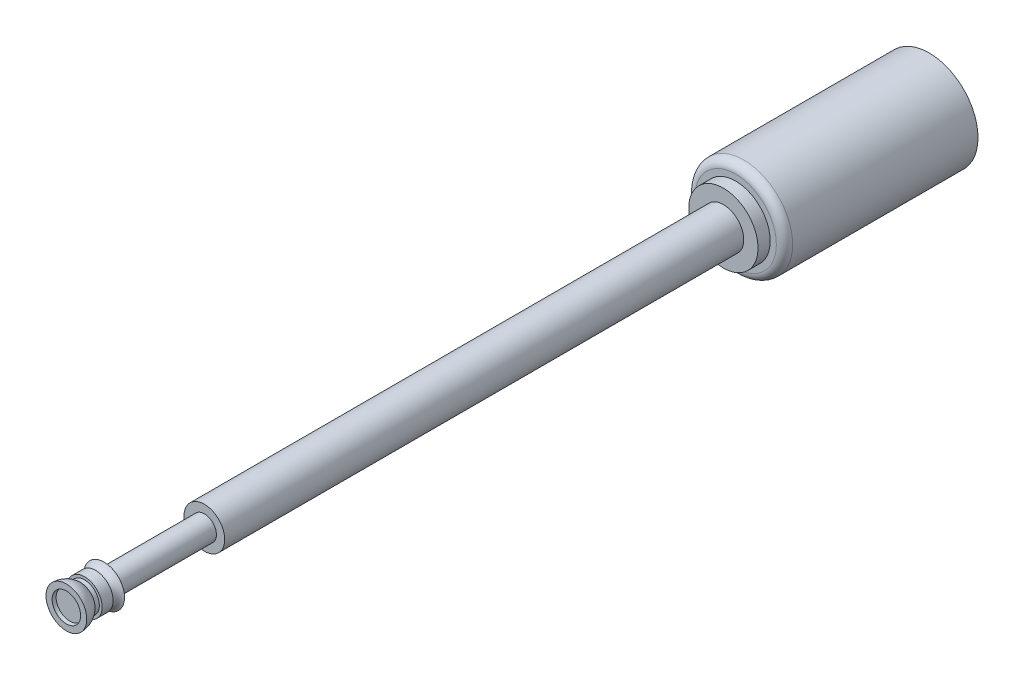
from build123d import *

# Parameters (mm, degrees)
SKETCH1_R           = 12.7
BOSS_EXTRUDE1_DEPTH = 393.7
SKETCH1_3_R         = 30.48
SKETCH1_3_R_2       = 12.7
BOSS_EXTRUDE2_DEPTH = 120.65
FILLET1_R           = 5.08
SKETCH2_R           = 21.59
BOSS_EXTRUDE3_DEPTH = 7.62
SKETCH4_W           = 11.455449348
SKETCH4_H           = 1.487714446
SKETCH5_W           = 19.408085654
SKETCH5_H           = 62.484


with BuildPart() as part:
    # Sketch1 → Boss-Extrude1 (new body)
    with BuildSketch(Plane.XY):
        Circle(SKETCH1_R)
    extrude(amount=BOSS_EXTRUDE1_DEPTH)



with BuildPart() as body_2:
    # Sketch1<3> → Boss-Extrude2 (new body)
    with BuildSketch(Plane.XY):
        Circle(SKETCH1_3_R)
        Circle(SKETCH1_3_R_2, mode=Mode.SUBTRACT)
    extrude(amount=-BOSS_EXTRUDE2_DEPTH)

    # Fillet1
    fillet1_edges = [body_2.edges().sort_by_distance(p)[0] for p in [
        (-30.48, 0, 0),
    ]]
    fillet(fillet1_edges, radius=FILLET1_R)


with BuildPart() as part_1:
    add(part.part)

    add(body_2.part)  # Boss-Extrude3 merges body 2
    # Sketch2 → Boss-Extrude3 (add)
    with BuildSketch(Plane.XY):
        Circle(SKETCH2_R)
    extrude(amount=BOSS_EXTRUDE3_DEPTH)

    # Sketch3 → Revolve2 (revolve)
    with BuildSketch(Plane(origin=(0, 0, 0), x_dir=(1, 0, 0), z_dir=(0, 1, 0))):
        with BuildLine():
            Line((12.7, -393.7), (0, -393.7))
            Line((0, -393.7), (0, -408.3685))
            ThreePointArc((0, -408.3685), (6.286179285, -410.972320715), (8.89, -417.2585))
            Line((8.89, -417.2585), (12.7, -417.2585))
            ThreePointArc((12.7, -417.2585), (11.805440428, -412.576451698), (9.247783259, -408.5539894))
            Line((9.247783259, -408.5539894), (9.247783259, -405.935541368))
            Line((9.247783259, -405.935541368), (10.947551139, -405.935541368))
            Line((10.947551139, -405.935541368), (10.947551139, -399.059207672))
            Line((10.947551139, -399.059207672), (9.170521083, -399.059207672))
            ThreePointArc((9.170521083, -399.059207672), (10.132151594, -395.850690557), (12.7, -393.7))
        make_face()
    revolve(axis=Axis((0, 0, 393.7), (0, 0, 1)))

    # Sketch4 → Revolve3 (revolve)
    with BuildSketch(Plane(origin=(0, 0, 0), x_dir=(1, 0, 0), z_dir=(0, 1, 0))):
        with Locations((-5.727724674, -414.292142777)):
            Rectangle(SKETCH4_W, SKETCH4_H)
    revolve(axis=Axis((0, 0, 393.7), (0, 0, 1)))

    # Sketch5 → Cut-Revolve1 (revolve, cut)
    with BuildSketch(Plane(origin=(0, 0, 0), x_dir=(1, 0, 0), z_dir=(0, 1, 0))):
        with Locations((-17.227522827, -362.458)):
            Rectangle(SKETCH5_W, SKETCH5_H)
    revolve(axis=Axis((0, 0, 417.2585), (0, 0, -1)), mode=Mode.SUBTRACT)


solid = part_1.part
